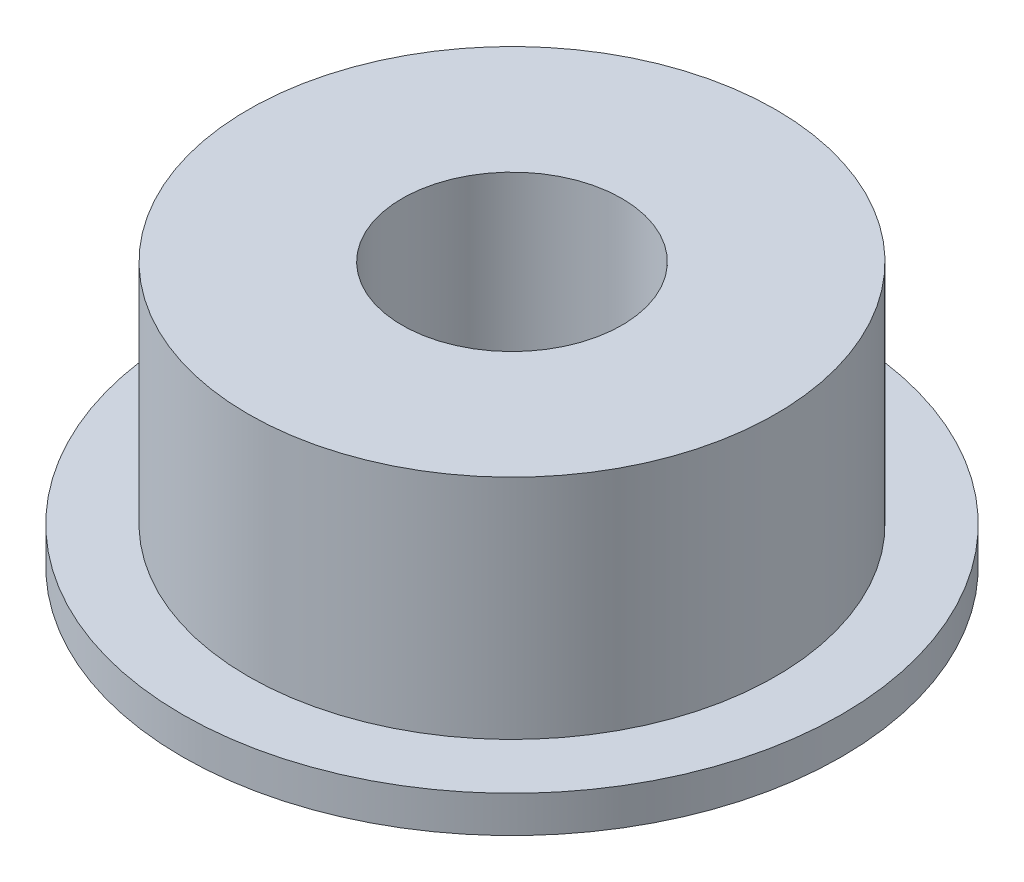
from build123d import *

# Parameters (mm, degrees)
SKETCH_1_R          = 4.5
EXTRUDE_1_DEPTH     = 0.5
SKETCH_2_R          = 3.6
EXTRUDE_2_DEPTH     = 3.1
SKETCH_3_R          = 1.5
CUT_EXTRUDE_1_DEPTH = 8.311634564


with BuildPart() as part:
    # 草图1 → 凸台-拉伸1 (new body)
    with BuildSketch(Plane(origin=(0, 0, 0), x_dir=(1, 0, 0), z_dir=(0, 1, 0))):
        with Locations(Location((0, 0, 0), (0, 0, 270))):
            Circle(SKETCH_1_R)
    extrude(amount=EXTRUDE_1_DEPTH)

    # 草图2 → 凸台-拉伸2 (add)
    with BuildSketch(Plane(origin=(0, 0.5, 0), x_dir=(1, 0, 0), z_dir=(0, 1, 0))):
        with Locations(Location((0, 0, 0), (0, 0, 90))):
            Circle(SKETCH_2_R)
    extrude(amount=EXTRUDE_2_DEPTH)

    # 草图3 → 切除-拉伸1 (cut, through all)
    with BuildSketch(Plane.XZ):
        with Locations(Location((0, 0, 0), (0, 0, 270))):
            Circle(SKETCH_3_R)
    extrude(amount=-CUT_EXTRUDE_1_DEPTH, mode=Mode.SUBTRACT)


solid = part.part
